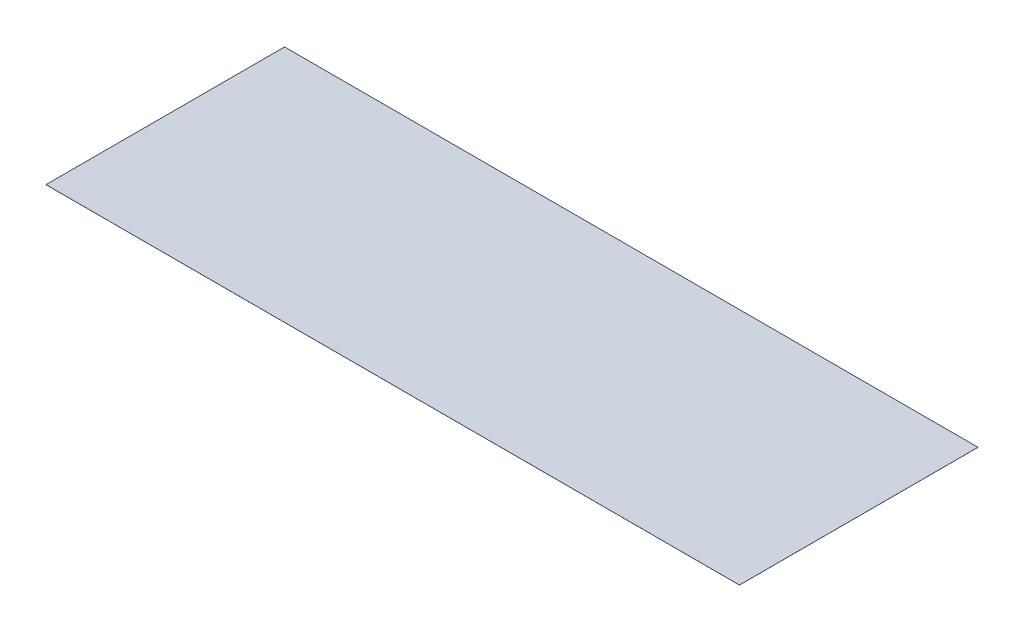
from build123d import *

# Parameters (mm, degrees)
SKETCH2_W           = 16720.87114023
SKETCH2_H           = 5751.975779537
BOSS_EXTRUDE1_DEPTH = 1


with BuildPart() as part:
    # Sketch2 → Boss-Extrude1 (new body)
    with BuildSketch(Plane(origin=(0, 0, 0), x_dir=(1, 0, 0), z_dir=(0, 1, 0))):
        with Locations((7684.932671107, -2616.492645144)):
            Rectangle(SKETCH2_W, SKETCH2_H)
    extrude(amount=BOSS_EXTRUDE1_DEPTH)


solid = part.part
